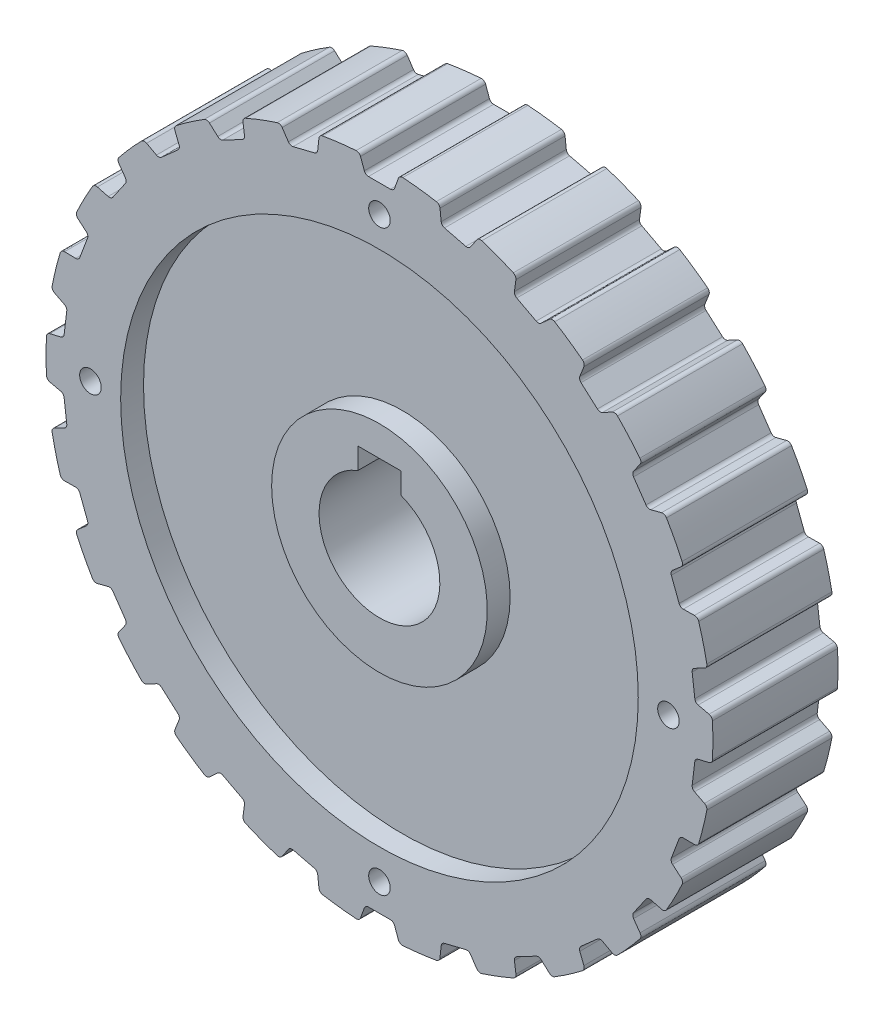
from build123d import *

# Parameters (mm, degrees)
CUT_EXTRUDE1_DEPTH              = 52.425309916
CUT_EXTRUDE1_DEPTH_BACK         = 52.425309916
SKETCH3_W                       = 5
SKETCH3_H                       = 9
M3X0_5_TAPPED_HOLE1_D           = 2.5
BOSS_EXTRUDE1_REACH             = 53.425
SKETCH7_R                       = 38.647197245
SKETCH7_R_2                     = 36
BOSS_EXTRUDE1_DIRECTION_2_REACH = 53.425
CUT_EXTRUDE2_DEPTH              = 56.134147402
CUT_EXTRUDE2_DEPTH_BACK         = 56.134147402
FILLET2_R                       = 0.51
SKETCH9_R                       = 30
SKETCH9_R_2                     = 12.5
BOSS_EXTRUDE2_DEPTH             = 0.6


with BuildPart() as part:
    # Sketch2 → Revolve1 (revolve)
    with BuildSketch(Plane(origin=(0, 0, 0), x_dir=(1, 0, 0), z_dir=(0, 1, 0)), mode=Mode.PRIVATE) as revolve1_sk:
        Polygon((7, 7.25), (12.5, 7.25), (12.5, 4), (30, 4), (30, 7.25), (36, 7.25), (36, -7.25), (30, -7.25), (30, -4), (12.5, -4), (12.5, -7.25), (7, -7.25), align=None)
    revolve(revolve1_sk.sketch.rotate(Axis((0, 0, -36.129595921), (0, 0, 1)), 180), axis=Axis((0, 0, -36.129595921), (0, 0, 1)))

    # Sketch3 → Cut-Extrude1 (cut, two sides: drawn at the far end of the back side and taken through both)
    with BuildSketch(Plane.XY.offset(-CUT_EXTRUDE1_DEPTH_BACK)):
        with Locations((0, 4.5)):
            Rectangle(SKETCH3_W, SKETCH3_H)
    extrude(amount=CUT_EXTRUDE1_DEPTH + CUT_EXTRUDE1_DEPTH_BACK, mode=Mode.SUBTRACT)

    # M3x0.5 Tapped Hole1 (through all)
    with Locations(Plane.XY.offset(7.25)):
        with Locations((0, 33.5), (33.5, 0), (-33.5, 0), (0, -33.5)):
            Hole(M3X0_5_TAPPED_HOLE1_D / 2)

    # Boss-Extrude1: up to this face of the body (flat: up to its plane)
    boss_extrude1_end = Plane(part.part.faces().sort_by_distance((34.981766235, 0, 7.25))[0])
    # Sketch7 → Boss-Extrude1 (add, up to the picked face)
    with BuildSketch(Plane.XY, mode=Mode.PRIVATE) as boss_extrude1_sk1:
        with Locations(Location((0, 0, 0), (0, 0, 180))):
            Circle(SKETCH7_R)
        Circle(SKETCH7_R_2, mode=Mode.SUBTRACT)
    boss_extrude1_tool1 = split(extrude(boss_extrude1_sk1.sketch, amount=BOSS_EXTRUDE1_REACH, mode=Mode.PRIVATE), bisect_by=boss_extrude1_end, keep=Keep.BOTH, mode=Mode.PRIVATE)
    add(boss_extrude1_tool1.solids().sort_by(Axis((37.554089, 0, 0), (0, 0, 1)))[0])

    # Boss-Extrude1 direction 2: up to this face of the body (flat: up to its plane)
    boss_extrude1_direction_2_end = Plane(part.part.faces().sort_by_distance((34.981766235, 0, -7.25))[0])
    # Sketch7 → Boss-Extrude1 direction 2 (add, up to the picked face)
    with BuildSketch(Plane.XY, mode=Mode.PRIVATE) as boss_extrude1_direction_2_sk1:
        with Locations(Location((0, 0, 0), (0, 0, 180))):
            Circle(SKETCH7_R)
        Circle(SKETCH7_R_2, mode=Mode.SUBTRACT)
    boss_extrude1_direction_2_tool1 = split(extrude(boss_extrude1_direction_2_sk1.sketch, amount=-BOSS_EXTRUDE1_DIRECTION_2_REACH, mode=Mode.PRIVATE), bisect_by=boss_extrude1_direction_2_end, keep=Keep.BOTH, mode=Mode.PRIVATE)
    add(boss_extrude1_direction_2_tool1.solids().sort_by(Axis((37.554089, 0, 0), (0, 0, -1)))[0])

    # Sketch8 → Cut-Extrude2 (cut, two sides: drawn at the far end of the back side and taken through both)
    with BuildSketch(Plane.XY.offset(-CUT_EXTRUDE2_DEPTH_BACK)):
        Polygon((-1.629816853, 36.667198316), (-2.350477527, 38.647197245), (2.350477527, 38.647197245), (1.629816853, 36.667198316), align=None)
        Polygon((7.192577586, 35.991756875), (6.96670276, 38.086686022), (11.531056603, 36.961673841), (10.357492259, 35.21167547), align=None)
        Polygon((15.596965558, 33.22460535), (15.879003605, 35.312715047), (20.041492583, 33.128072303), (18.483227864, 31.709778035), align=None)
        Polygon((23.094914586, 28.526560528), (23.868474478, 30.48649743), (27.387189863, 27.369187619), (25.534785449, 26.365023561), align=None)
        Polygon((29.250671124, 22.170655698), (30.470796374, 23.888515396), (33.141243215, 20.019705233), (31.102354119, 19.48802975), align=None)
        Polygon((33.706484978, 14.526272947), (35.30226634, 15.902219679), (36.969247976, 11.506750348), (34.86236702, 11.478462487), align=None)
        Polygon((36.203400443, 6.037676012), (38.082096906, 6.991744756), (38.648734422, 2.325064958), (36.596305869, 2.801808707), align=None)
        Polygon((36.596305869, -2.801808707), (38.648734422, -2.325064958), (38.082096906, -6.991744756), (36.203400443, -6.037676012), align=None)
        Polygon((34.86236702, -11.478462487), (36.969247976, -11.506750348), (35.30226634, -15.902219679), (33.706484978, -14.526272947), align=None)
        Polygon((31.102354119, -19.48802975), (33.141243215, -20.019705233), (30.470796374, -23.888515396), (29.250671124, -22.170655698), align=None)
        Polygon((25.534785449, -26.365023561), (27.387189863, -27.369187619), (23.868474478, -30.48649743), (23.094914586, -28.526560528), align=None)
        Polygon((18.483227864, -31.709778035), (20.041492583, -33.128072303), (15.879003605, -35.312715047), (15.596965558, -33.22460535), align=None)
        Polygon((10.357492259, -35.21167547), (11.531056603, -36.961673841), (6.96670276, -38.086686022), (7.192577586, -35.991756875), align=None)
        Polygon((1.629816853, -36.667198316), (2.350477527, -38.647197245), (-2.350477527, -38.647197245), (-1.629816853, -36.667198316), align=None)
        Polygon((-7.192577586, -35.991756875), (-6.96670276, -38.086686022), (-11.531056603, -36.961673841), (-10.357492259, -35.21167547), align=None)
        Polygon((-15.596965558, -33.22460535), (-15.879003605, -35.312715047), (-20.041492583, -33.128072303), (-18.483227864, -31.709778035), align=None)
        Polygon((-23.094914586, -28.526560528), (-23.868474478, -30.48649743), (-27.387189863, -27.369187619), (-25.534785449, -26.365023561), align=None)
        Polygon((-29.250671124, -22.170655698), (-30.470796374, -23.888515396), (-33.141243215, -20.019705233), (-31.102354119, -19.48802975), align=None)
        Polygon((-33.706484978, -14.526272947), (-35.30226634, -15.902219679), (-36.969247976, -11.506750348), (-34.86236702, -11.478462487), align=None)
        Polygon((-36.203400443, -6.037676012), (-38.082096906, -6.991744756), (-38.648734422, -2.325064958), (-36.596305869, -2.801808707), align=None)
        Polygon((-36.596305869, 2.801808707), (-38.648734422, 2.325064958), (-38.082096906, 6.991744756), (-36.203400443, 6.037676012), align=None)
        Polygon((-34.86236702, 11.478462487), (-36.969247976, 11.506750348), (-35.30226634, 15.902219679), (-33.706484978, 14.526272947), align=None)
        Polygon((-31.102354119, 19.48802975), (-33.141243215, 20.019705233), (-30.470796374, 23.888515396), (-29.250671124, 22.170655698), align=None)
        Polygon((-25.534785449, 26.365023561), (-27.387189863, 27.369187619), (-23.868474478, 30.48649743), (-23.094914586, 28.526560528), align=None)
        Polygon((-18.483227864, 31.709778035), (-20.041492583, 33.128072303), (-15.879003605, 35.312715047), (-15.596965558, 33.22460535), align=None)
        Polygon((-10.357492259, 35.21167547), (-11.531056603, 36.961673841), (-6.96670276, 38.086686022), (-7.192577586, 35.991756875), align=None)
    extrude(amount=CUT_EXTRUDE2_DEPTH + CUT_EXTRUDE2_DEPTH_BACK, mode=Mode.SUBTRACT)

    # Fillet2
    fillet2_edges = [part.edges().sort_by_distance(p)[0] for p in [
        (2.325, 38.577198316, 0),
        (-2.325, 38.577198316, 0),
        (-6.974688116, 38.012623963, 0),
        (-11.489567567, 36.899806124, 0),
        (-15.86903271, 35.238894076, 0),
        (-19.986403229, 33.077931326, 0),
        (-23.841126805, 30.417207754, 0),
        (-27.321701784, 27.333687393, 0),
        (-30.427661269, 23.827783879, 0),
        (-33.069162341, 20.000908903, 0),
        (-35.24585066, 15.853575815, 0),
        (-36.894763385, 11.505750287, 0),
        (-38.015679324, 6.958015551, 0),
        (-38.576174887, 2.341919286, 0),
        (-38.576174887, -2.341919286, 0),
        (-38.015679324, -6.958015551, 0),
        (-36.894763385, -11.505750287, 0),
        (-35.24585066, -15.853575815, 0),
        (-33.069162341, -20.000908903, 0),
        (-30.427661269, -23.827783879, 0),
        (-27.321701784, -27.333687393, 0),
        (-23.841126805, -30.417207754, 0),
        (-19.986403229, -33.077931326, 0),
        (-15.86903271, -35.238894076, 0),
        (-11.489567567, -36.899806124, 0),
        (-6.974688116, -38.012623963, 0),
        (-2.325, -38.577198316, 0),
        (2.325, -38.577198316, 0),
        (6.974688116, -38.012623963, 0),
        (11.489567567, -36.899806124, 0),
        (15.86903271, -35.238894076, 0),
        (19.986403229, -33.077931326, 0),
        (23.841126805, -30.417207754, 0),
        (27.321701784, -27.333687393, 0),
        (30.427661269, -23.827783879, 0),
        (33.069162341, -20.000908903, 0),
        (35.24585066, -15.853575815, 0),
        (36.894763385, -11.505750287, 0),
        (38.015679324, -6.958015551, 0),
        (38.576174887, -2.341919286, 0),
        (38.576174887, 2.341919286, 0),
        (38.015679324, 6.958015551, 0),
        (36.894763385, 11.505750287, 0),
        (35.24585066, 15.853575815, 0),
        (33.069162341, 20.000908903, 0),
        (30.427661269, 23.827783879, 0),
        (27.321701784, 27.333687393, 0),
        (23.841126805, 30.417207754, 0),
        (19.986403229, 33.077931326, 0),
        (15.86903271, 35.238894076, 0),
        (11.489567567, 36.899806124, 0),
        (6.974688116, 38.012623963, 0),
        (7.192577586, 35.991756875, 0),
        (10.357492259, 35.21167547, 0),
        (15.596965558, 33.22460535, 0),
        (18.483227864, 31.709778035, 0),
        (23.094914586, 28.526560528, 0),
        (25.534785449, 26.365023561, 0),
        (29.250671124, 22.170655698, 0),
        (31.102354119, 19.48802975, 0),
        (33.706484978, 14.526272947, 0),
        (34.86236702, 11.478462487, 0),
        (36.203400443, 6.037676012, 0),
        (36.596305869, 2.801808707, 0),
        (36.596305869, -2.801808707, 0),
        (36.203400443, -6.037676012, 0),
        (34.86236702, -11.478462487, 0),
        (33.706484978, -14.526272947, 0),
        (31.102354119, -19.48802975, 0),
        (29.250671124, -22.170655698, 0),
        (25.534785449, -26.365023561, 0),
        (23.094914586, -28.526560528, 0),
        (18.483227864, -31.709778035, 0),
        (15.596965558, -33.22460535, 0),
        (10.357492259, -35.21167547, 0),
        (7.192577586, -35.991756875, 0),
        (1.629816853, -36.667198316, 0),
        (-1.629816853, -36.667198316, 0),
        (-7.192577586, -35.991756875, 0),
        (-10.357492259, -35.21167547, 0),
        (-15.596965558, -33.22460535, 0),
        (-18.483227864, -31.709778035, 0),
        (-23.094914586, -28.526560528, 0),
        (-25.534785449, -26.365023561, 0),
        (-29.250671124, -22.170655698, 0),
        (-31.102354119, -19.48802975, 0),
        (-33.706484978, -14.526272947, 0),
        (-34.86236702, -11.478462487, 0),
        (-36.203400443, -6.037676012, 0),
        (-36.596305869, -2.801808707, 0),
        (-36.596305869, 2.801808707, 0),
        (-36.203400443, 6.037676012, 0),
        (-34.86236702, 11.478462487, 0),
        (-33.706484978, 14.526272947, 0),
        (-31.102354119, 19.48802975, 0),
        (-29.250671124, 22.170655698, 0),
        (-25.534785449, 26.365023561, 0),
        (-23.094914586, 28.526560528, 0),
        (-18.483227864, 31.709778035, 0),
        (-15.596965558, 33.22460535, 0),
        (-10.357492259, 35.21167547, 0),
        (-7.192577586, 35.991756875, 0),
        (-1.629816853, 36.667198316, 0),
        (1.629816853, 36.667198316, 0),
    ]]
    fillet(fillet2_edges, radius=FILLET2_R)

    # Sketch9 → Boss-Extrude2 (add)
    with BuildSketch(Plane.XY.offset(4)):
        with Locations(Location((0, 0, 0), (0, 0, 180))):
            Circle(SKETCH9_R)
        with Locations(Location((0, 0, 0), (0, 0, 180))):
            Circle(SKETCH9_R_2, mode=Mode.SUBTRACT)
    extrude(amount=BOSS_EXTRUDE2_DEPTH)


solid = part.part
